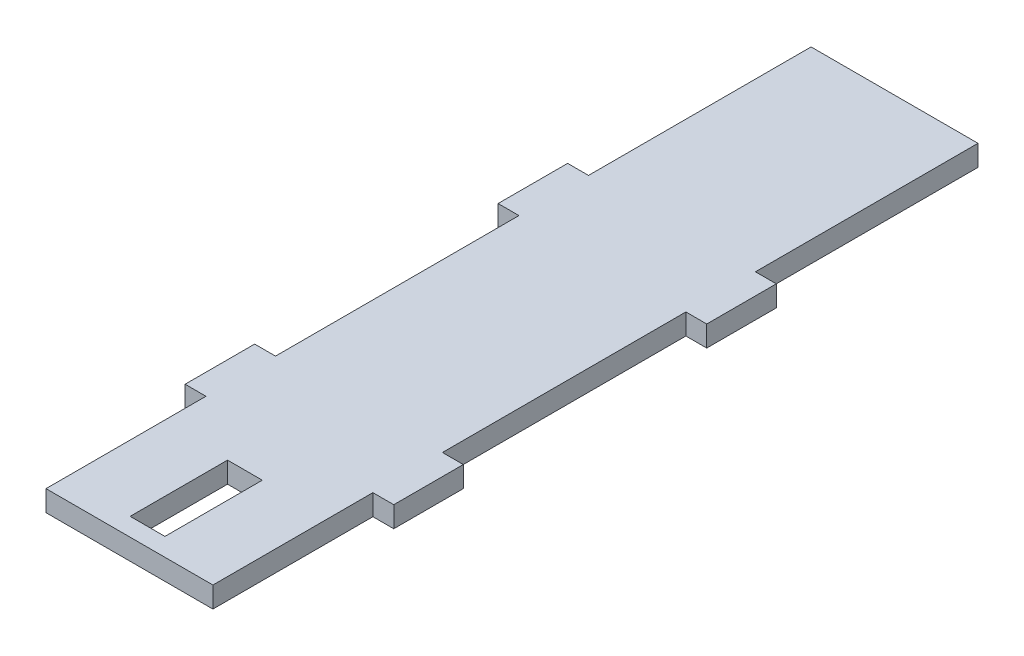
from build123d import *

# Parameters (mm, degrees)
EXTRUDE_1_DEPTH     = 3
SKETCH_2_W          = 5
SKETCH_2_H          = 14
CUT_EXTRUDE_1_DEPTH = 10


with BuildPart() as part:
    # Эскиз1 → Бобышка-Вытянуть1 (new body)
    with BuildSketch(Plane(origin=(0, 0, 0), x_dir=(1, 0, 0), z_dir=(0, 1, 0))):
        Polygon((-12, -55), (12, -55), (12, -32), (15, -32), (15, -22), (12, -22), (12, 13), (15, 13), (15, 23), (12, 23), (12, 55), (-12, 55), (-12, 23), (-15, 23), (-15, 13), (-12, 13), (-12, -22), (-15, -22), (-15, -32), (-12, -32), align=None)
    extrude(amount=EXTRUDE_1_DEPTH)

    # Эскиз2 → Вырез-Вытянуть1 (cut)
    with BuildSketch(Plane(origin=(0, 3, 0), x_dir=(1, 0, 0), z_dir=(0, 1, 0))):
        with Locations((0, -45.4)):
            Rectangle(SKETCH_2_W, SKETCH_2_H)
    extrude(amount=-CUT_EXTRUDE_1_DEPTH, mode=Mode.SUBTRACT)


solid = part.part
